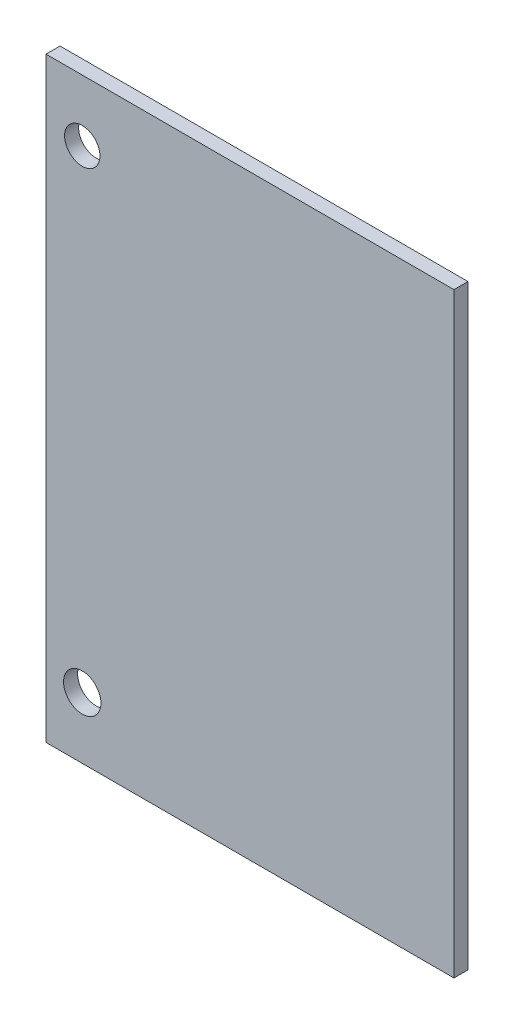
from build123d import *

# Parameters (mm, degrees)
SKETCH_1_W          = 69.8
SKETCH_1_H          = 51
SKETCH_1_R          = 1.512119171
SKETCH_1_R_2        = 1.6
EXTRUDE_1_DEPTH     = 1.2
SKETCH_2_W          = 34.9
SKETCH_2_H          = 51
CUT_EXTRUDE_1_DEPTH = 342.903054224


with BuildPart() as part:
    # Эскиз1 → Бобышка-Вытянуть1 (new body)
    with BuildSketch(Plane.XY):
        with Locations((-305.123327031, 10.282615371)):
            Rectangle(SKETCH_1_W, SKETCH_1_H)
        with Locations((-336.923327031, 30.532615371)):
            Circle(SKETCH_1_R, mode=Mode.SUBTRACT)
        with Locations((-336.923327031, -9.967384629)):
            Circle(SKETCH_1_R_2, mode=Mode.SUBTRACT)
        with Locations((-273.323327031, 30.532615371)):
            Circle(SKETCH_1_R_2, mode=Mode.SUBTRACT)
        with Locations((-273.323327031, -9.967384629)):
            Circle(SKETCH_1_R_2, mode=Mode.SUBTRACT)
    extrude(amount=EXTRUDE_1_DEPTH)

    # Эскиз2 → Вырез-Вытянуть1 (cut, through all)
    with BuildSketch(Plane.XY.offset(1.2)):
        with Locations((-287.673327031, 10.282615371)):
            Rectangle(SKETCH_2_W, SKETCH_2_H)
    extrude(amount=-CUT_EXTRUDE_1_DEPTH, mode=Mode.SUBTRACT)


solid = part.part
